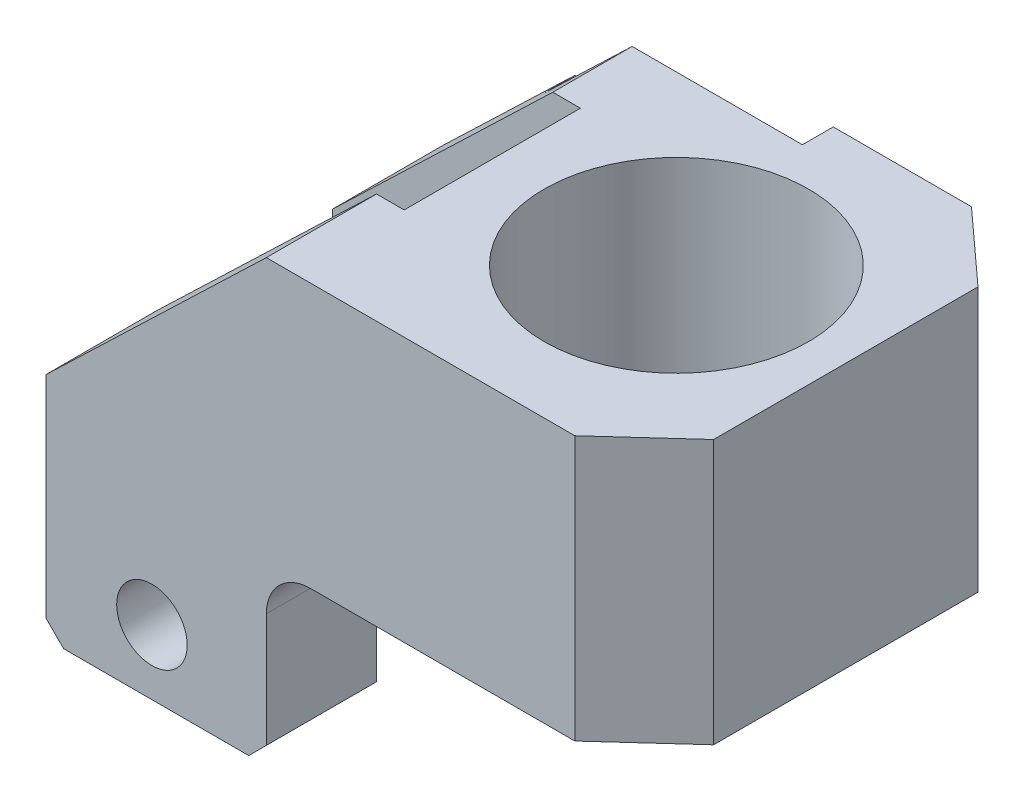
from build123d import *

# Parameters (mm, degrees)
EXTRUDE_1_DEPTH       = 30
SKETCH_2_R            = 15
CUT_EXTRUDE_2_DEPTH   = 45.532745299
EXTRUDE_3_DEPTH       = 45
CUT_EXTRUDE_START     = 70
SKETCH_3_W            = 44.656689001
SKETCH_3_H            = 20
CUT_EXTRUDE_1_DEPTH   = 130
SKETCH_7_R            = 3.999999997
CUT_EXTRUDE_2_2_DEPTH = 73.992250074
FILLET_1_R            = 5
CHAMFER_5_SIZE        = 2
SKETCH_10_R           = 17
CUT_EXTRUDE_5_DEPTH   = 3.5


with BuildPart() as part:
    # Эскиз1 → Вытянуть1 (new body)
    with BuildSketch(Plane(origin=(0, 0, 0), x_dir=(1, 0, 0), z_dir=(0, 1, 0))):
        Polygon((-24.019063342, 22.5), (10.980936658, 22.5), (19.22346273, 15), (19.22346273, -15), (10.980936658, -22.5), (-24.019063342, -22.5), align=None)
    extrude(amount=EXTRUDE_1_DEPTH)

    # Эскиз2 → Cut-Extrude 2 (cut, through all)
    with BuildSketch(Plane(origin=(0, 30, 0), x_dir=(1, 0, 0), z_dir=(0, 1, 0))):
        with Locations(Location((0, 0, 0), (0, 0, 270))):
            Circle(SKETCH_2_R)
    extrude(amount=-CUT_EXTRUDE_2_DEPTH, mode=Mode.SUBTRACT)

    # Эскиз6 → Вытянуть3 (add)
    with BuildSketch(Plane(origin=(0, 0, -22.5), x_dir=(-1, 0, 0), z_dir=(0, 0, -1))):
        Polygon((24.019063342, -19.927530698), (24.019063342, 30), (49.019063342, 6.012561534), (49.019063342, -19.927530698), align=None)
    extrude(amount=-EXTRUDE_3_DEPTH)

    # Эскиз3 → Вырез-Вытянуть1 (cut)
    with BuildSketch(Plane(origin=(0, 30, 0), x_dir=(1, 0, 0), z_dir=(0, 1, 0)).offset(CUT_EXTRUDE_START)):
        with Locations((-43.210774099, 0)):
            Rectangle(SKETCH_3_W, SKETCH_3_H)
    extrude(amount=-CUT_EXTRUDE_1_DEPTH, mode=Mode.SUBTRACT)

    # Эскиз7 → Cut-Extrude 2 2 (cut, through all)
    with BuildSketch(Plane(origin=(0, 0, -22.5), x_dir=(-1, 0, 0), z_dir=(0, 0, -1))):
        with Locations((37.000000002, -12.578306382)):
            Circle(SKETCH_7_R)
    extrude(amount=-CUT_EXTRUDE_2_2_DEPTH, mode=Mode.SUBTRACT)

    # Скругление1
    fillet_1_edges = [part.edges().sort_by_distance(p)[0] for p in [
        (-24.019063342, 0, -16.25),
    ]]
    fillet(fillet_1_edges, radius=FILLET_1_R)

    # Фаска5
    chamfer_5_edges = [part.edges().sort_by_distance(p)[0] for p in [
        (-49.019063342, -19.927530698, 16.25),
        (-24.019063342, -19.927530698, 16.25),
        (-24.019063342, -19.927530698, -16.25),
        (-49.019063342, -19.927530698, -16.25),
    ]]
    chamfer(chamfer_5_edges, length=CHAMFER_5_SIZE)

    # Эскиз10 → Вырез-Вытянуть5 (cut)
    with BuildSketch(Plane(origin=(0, 0, -22.5), x_dir=(-1, 0, 0), z_dir=(0, 0, -1))):
        with Locations((21.57600878, 32.059441466)):
            Circle(SKETCH_10_R)
    extrude(amount=-CUT_EXTRUDE_5_DEPTH, mode=Mode.SUBTRACT)


solid = part.part
